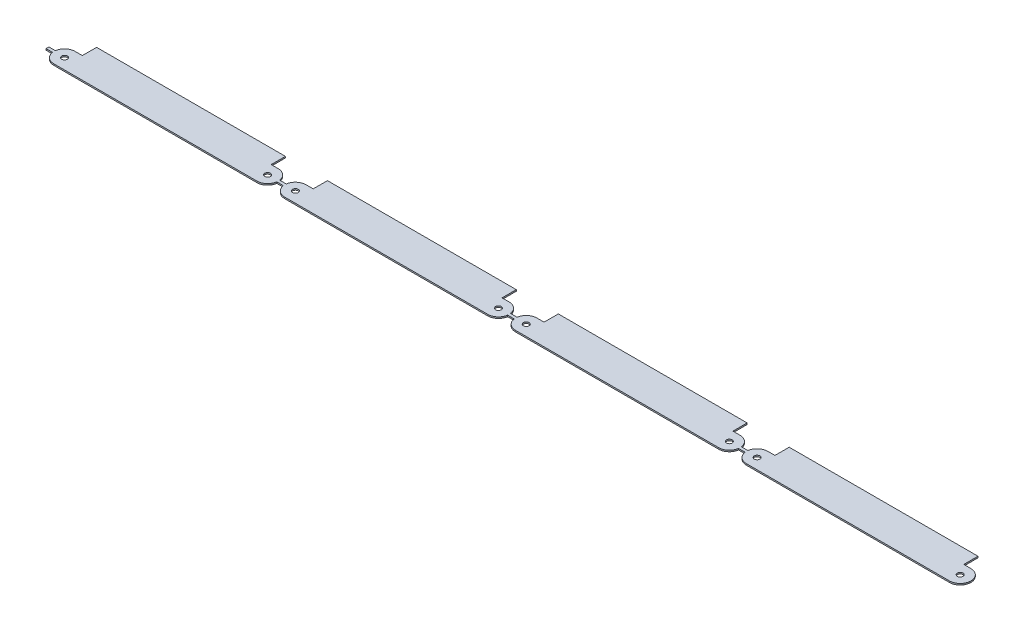
from build123d import *

# Parameters (mm, degrees)
SKETCH1_R           = 2
BOSS_EXTRUDE1_DEPTH = 1


with BuildPart() as part:
    # Sketch1 → Boss-Extrude1 (new body)
    with BuildSketch(Plane(origin=(0, 0, 0), x_dir=(1, 0, 0), z_dir=(0, 1, 0))):
        with BuildLine():
            Line((5, 7.5), (0, 7.5))
            ThreePointArc((0, 7.5), (-4.937104415, 5.645794895), (-7.433034374, 1))
            Line((-7.433034374, 1), (-12.003034374, 1))
            Line((-12.003034374, 1), (-12.003034374, -1))
            Line((-12.003034374, -1), (-7.433034374, -1))
            ThreePointArc((-7.433034374, -1), (-4.937104415, -5.645794895), (0, -7.5))
            Line((0, -7.5), (142.5, -7.5))
            ThreePointArc((142.5, -7.5), (147.437104415, -5.645794895), (149.933034374, -1))
            Line((149.933034374, -1), (154.566965626, -1))
            ThreePointArc((154.566965626, -1), (157.062895585, -5.645794895), (162, -7.5))
            Line((162, -7.5), (304.5, -7.5))
            ThreePointArc((304.5, -7.5), (309.437104415, -5.645794895), (311.933034374, -1))
            Line((311.933034374, -1), (316.566965626, -1))
            ThreePointArc((316.566965626, -1), (319.062895585, -5.645794895), (324, -7.5))
            Line((324, -7.5), (466.5, -7.5))
            ThreePointArc((466.5, -7.5), (471.437104415, -5.645794895), (473.933034374, -1))
            Line((473.933034374, -1), (478.566965626, -1))
            ThreePointArc((478.566965626, -1), (481.062895585, -5.645794895), (486, -7.5))
            Line((486, -7.5), (628.5, -7.5))
            ThreePointArc((628.5, -7.5), (633.437104415, -5.645794895), (635.933034374, -1))
            Line((635.933034374, -1), (636, -1))
            Line((636, -1), (636, 1))
            Line((636, 1), (635.933034374, 1))
            ThreePointArc((635.933034374, 1), (633.437104415, 5.645794895), (628.5, 7.5))
            Line((628.5, 7.5), (623.5, 7.5))
            Line((623.5, 7.5), (623.5, 17.5))
            Line((623.5, 17.5), (491, 17.5))
            Line((491, 17.5), (491, 7.5))
            Line((491, 7.5), (486, 7.5))
            ThreePointArc((486, 7.5), (481.062895585, 5.645794895), (478.566965626, 1))
            Line((478.566965626, 1), (473.933034374, 1))
            ThreePointArc((473.933034374, 1), (471.437104415, 5.645794895), (466.5, 7.5))
            Line((466.5, 7.5), (461.5, 7.5))
            Line((461.5, 7.5), (461.5, 17.5))
            Line((461.5, 17.5), (329, 17.5))
            Line((329, 17.5), (329, 7.5))
            Line((329, 7.5), (324, 7.5))
            ThreePointArc((324, 7.5), (319.062895585, 5.645794895), (316.566965626, 1))
            Line((316.566965626, 1), (311.933034374, 1))
            ThreePointArc((311.933034374, 1), (309.437104415, 5.645794895), (304.5, 7.5))
            Line((304.5, 7.5), (299.5, 7.5))
            Line((299.5, 7.5), (299.5, 17.5))
            Line((299.5, 17.5), (167, 17.5))
            Line((167, 17.5), (167, 7.5))
            Line((167, 7.5), (162, 7.5))
            ThreePointArc((162, 7.5), (157.062895585, 5.645794895), (154.566965626, 1))
            Line((154.566965626, 1), (149.933034374, 1))
            ThreePointArc((149.933034374, 1), (147.437104415, 5.645794895), (142.5, 7.5))
            Line((142.5, 7.5), (137.5, 7.5))
            Line((137.5, 7.5), (137.5, 17.5))
            Line((137.5, 17.5), (5, 17.5))
            Line((5, 17.5), (5, 7.5))
        make_face()
        with Locations(Location((0, 0, 0), (0, 0, 270))):
            Circle(SKETCH1_R, mode=Mode.SUBTRACT)
        with Locations(Location((142.5, 0, 0), (0, 0, 270))):
            Circle(SKETCH1_R, mode=Mode.SUBTRACT)
        with Locations(Location((304.5, 0, 0), (0, 0, 270))):
            Circle(SKETCH1_R, mode=Mode.SUBTRACT)
        with Locations(Location((162, 0, 0), (0, 0, 270))):
            Circle(SKETCH1_R, mode=Mode.SUBTRACT)
        with Locations(Location((466.5, 0, 0), (0, 0, 270))):
            Circle(SKETCH1_R, mode=Mode.SUBTRACT)
        with Locations(Location((324, 0, 0), (0, 0, 270))):
            Circle(SKETCH1_R, mode=Mode.SUBTRACT)
        with Locations(Location((628.5, 0, 0), (0, 0, 270))):
            Circle(SKETCH1_R, mode=Mode.SUBTRACT)
        with Locations(Location((486, 0, 0), (0, 0, 270))):
            Circle(SKETCH1_R, mode=Mode.SUBTRACT)
    extrude(amount=BOSS_EXTRUDE1_DEPTH)


solid = part.part
